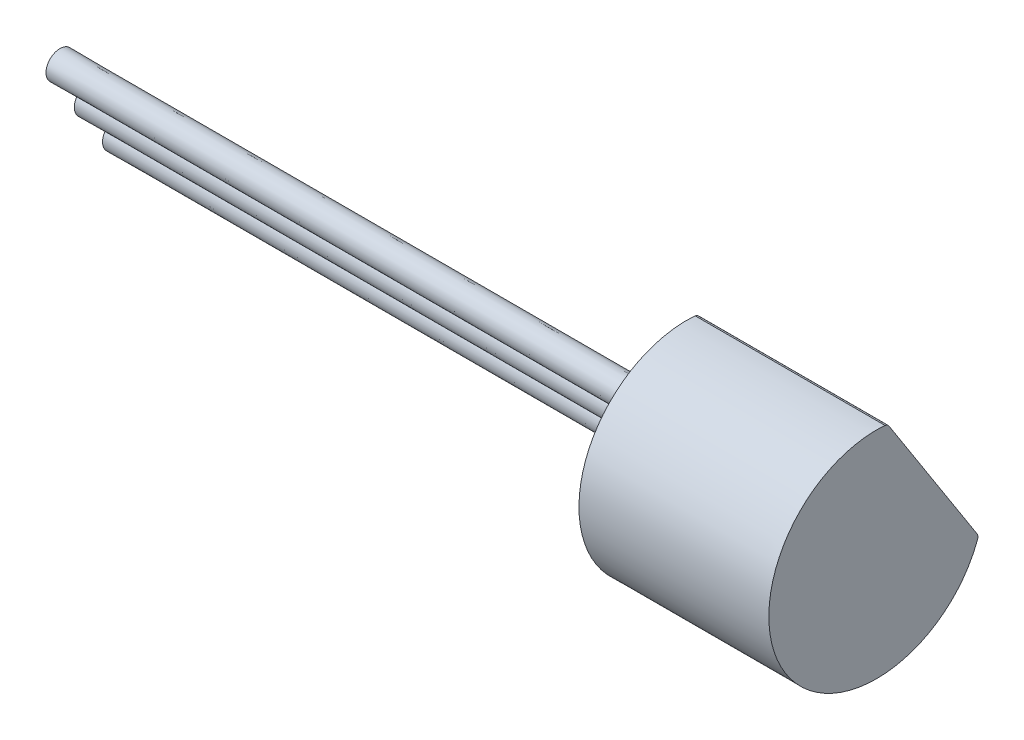
from build123d import *

# Parameters (mm, degrees)
BOSS_EXTRUDE1_DEPTH = 4.6
BOSS_EXTRUDE2_DEPTH = 14.5


with BuildPart() as part:
    # Sketch1 → Boss-Extrude1 (new body)
    with BuildSketch(Plane.YZ):
        with BuildLine():
            Line((229.674293499, -151.143340678), (226.326149061, -153.290122953))
            Line((226.326149061, -153.290122953), (226.272491625, -153.307881389))
            Line((226.272491625, -153.307881389), (226.216442541, -153.300599253))
            add(Edge.make_bspline(
                [(226.216442541, -153.300599253), (225.874904083, -153.174533582), (225.580435107, -152.959521565), (225.286628269, -152.74499302), (225.062097982, -152.457360168), (224.838244561, -152.170594409), (224.701034241, -151.832482244), (224.564237553, -151.495389348), (224.52483063, -151.132631023), (224.485542502, -150.770966265), (224.546949824, -150.411277999), (224.608172029, -150.052674045), (224.765701828, -149.723537492), (224.92275674, -149.39539315), (225.164373094, -149.121955689), (225.405261075, -148.849342529), (225.712503507, -148.652495899), (226.01881973, -148.45624268), (226.368213662, -148.351026769), (226.716554316, -148.24612804), (227.081404623, -148.240581773), (227.445155058, -148.235052226), (227.797585685, -148.329599361), (228.14895388, -148.423861475), (228.462037686, -148.611278225), (228.774177674, -148.79812999), (229.023993777, -149.064096948), (229.273056788, -149.329262125), (229.440518215, -149.653458328), (229.607474816, -149.976677214), (229.67978683, -150.334332747), (229.751936455, -150.691185103), (229.723518522, -151.054698615)],
                knots=[0, 0, 0, 0.0625, 0.0625, 0.125, 0.125, 0.1875, 0.1875, 0.25, 0.25, 0.3125, 0.3125, 0.375, 0.375, 0.4375, 0.4375, 0.5, 0.5, 0.5625, 0.5625, 0.625, 0.625, 0.6875, 0.6875, 0.75, 0.75, 0.8125, 0.8125, 0.875, 0.875, 0.9375, 0.9375, 1, 1, 1], degree=2))
            Line((229.723518522, -151.054698615), (229.706686704, -151.108654203))
            Line((229.706686704, -151.108654203), (229.674293499, -151.143340678))
        make_face()
    extrude(amount=BOSS_EXTRUDE1_DEPTH)

    # Sketch2 → Boss-Extrude2 (add)
    with BuildSketch(Plane(origin=(0, 0, 0), x_dir=(0, -1, 0), z_dir=(-1, 0, 0))):
        with BuildLine():
            add(Edge.make_bspline(
                [(-225.765572547, -151.715949147), (-225.741758397, -151.67876225), (-225.708923966, -151.594914599), (-225.711552038, -151.459869117), (-225.765659729, -151.33610908), (-225.863009632, -151.242475831), (-225.988781109, -151.193224184), (-226.123826591, -151.195852256), (-226.247586628, -151.249959946), (-226.341219877, -151.34730985), (-226.390471524, -151.473081327), (-226.387843452, -151.608126809), (-226.333735761, -151.731886846), (-226.236385858, -151.825520095), (-226.110614381, -151.874771742), (-225.975568899, -151.87214367), (-225.851808862, -151.818035979), (-225.789386696, -151.753136043), (-225.765572547, -151.715949147)],
                knots=[0, 0, 0, 0, 0.0625, 0.125, 0.1875, 0.25, 0.3125, 0.375, 0.4375, 0.5, 0.5625, 0.625, 0.6875, 0.75, 0.8125, 0.875, 0.9375, 1, 1, 1, 1], degree=3))
        make_face()
        with BuildLine():
            add(Edge.make_bspline(
                [(-226.835067383, -151.031054414), (-226.811253234, -150.993867518), (-226.778418803, -150.910019867), (-226.781046875, -150.774974384), (-226.835154565, -150.651214347), (-226.932504469, -150.557581098), (-227.058275945, -150.508329452), (-227.193321428, -150.510957524), (-227.317081465, -150.565065214), (-227.410714714, -150.662415118), (-227.45996636, -150.788186594), (-227.457338289, -150.923232076), (-227.403230598, -151.046992114), (-227.305880694, -151.140625362), (-227.180109218, -151.189877009), (-227.045063736, -151.187248937), (-226.921303698, -151.133141247), (-226.858881533, -151.068241311), (-226.835067383, -151.031054414)],
                knots=[0, 0, 0, 0, 0.0625, 0.125, 0.1875, 0.25, 0.3125, 0.375, 0.4375, 0.5, 0.5625, 0.625, 0.6875, 0.75, 0.8125, 0.875, 0.9375, 1, 1, 1, 1], degree=3))
        make_face()
        with BuildLine():
            add(Edge.make_bspline(
                [(-227.90456222, -150.346159682), (-227.880748071, -150.308972785), (-227.847913639, -150.225125134), (-227.850541711, -150.090079652), (-227.904649402, -149.966319615), (-228.001999305, -149.872686366), (-228.127770782, -149.823434719), (-228.262816264, -149.826062791), (-228.386576301, -149.880170482), (-228.48020955, -149.977520385), (-228.529461197, -150.103291862), (-228.526833125, -150.238337344), (-228.472725435, -150.362097381), (-228.375375531, -150.45573063), (-228.249604054, -150.504982277), (-228.114558572, -150.502354205), (-227.990798535, -150.448246514), (-227.928376369, -150.383346579), (-227.90456222, -150.346159682)],
                knots=[0, 0, 0, 0, 0.0625, 0.125, 0.1875, 0.25, 0.3125, 0.375, 0.4375, 0.5, 0.5625, 0.625, 0.6875, 0.75, 0.8125, 0.875, 0.9375, 1, 1, 1, 1], degree=3))
        make_face()
    extrude(amount=BOSS_EXTRUDE2_DEPTH)


solid = part.part
